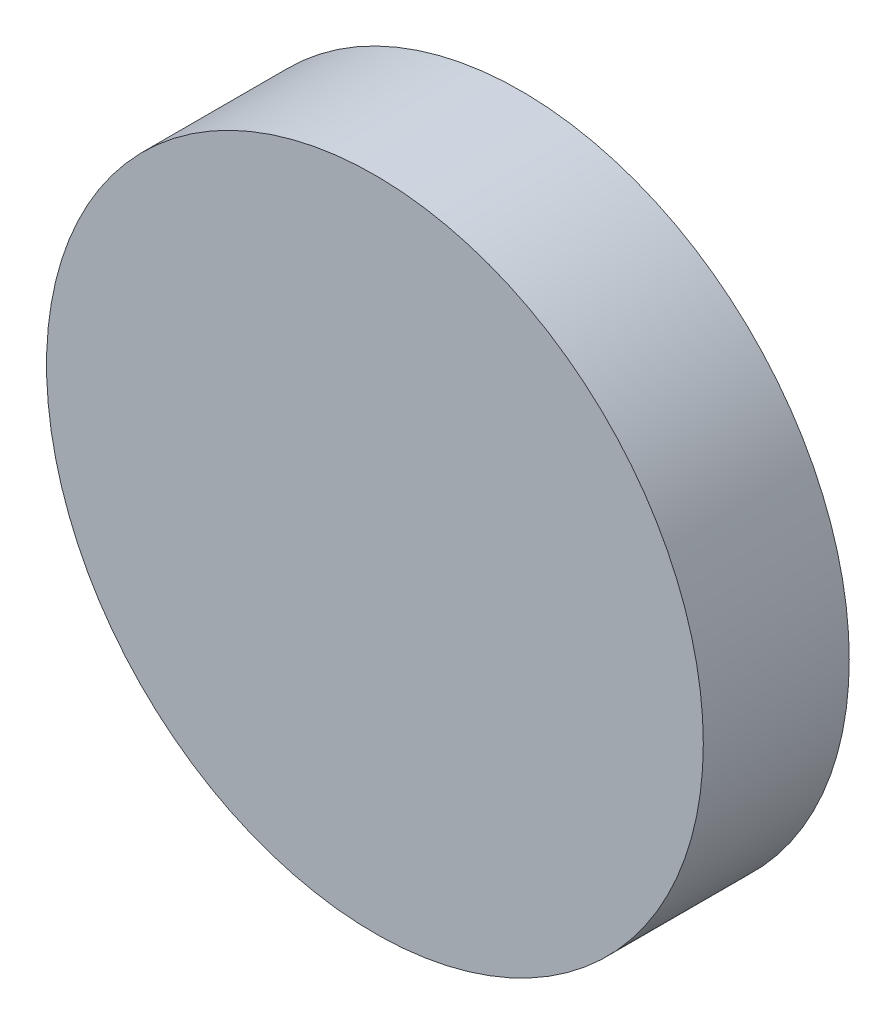
from build123d import *

# Parameters (mm, degrees)
STORE_EVAP_FAN_2_START = -750
SKETCH1_R              = 90
STORE_EVAP_FAN_2_DEPTH = 40


with BuildPart() as part:
    # Sketch1 → STORE_evap_fan_2 (new body)
    with BuildSketch(Plane.XY.offset(STORE_EVAP_FAN_2_START)):
        with Locations((700, 550)):
            Circle(SKETCH1_R)
    extrude(amount=-STORE_EVAP_FAN_2_DEPTH)


solid = part.part
